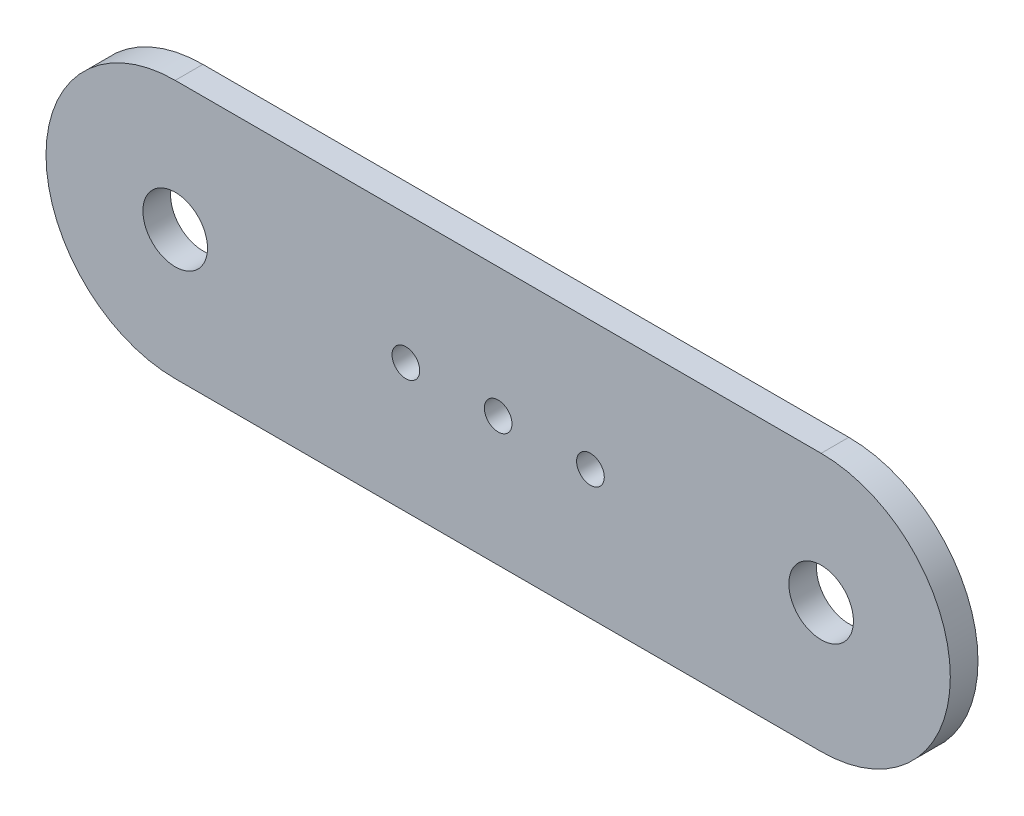
from build123d import *

# Parameters (mm, degrees)
SKETCH1_R           = 1.5
SKETCH1_R_2         = 3.5
BOSS_EXTRUDE1_DEPTH = 3


with BuildPart() as part:
    # Sketch1 → Boss-Extrude1 (new body)
    with BuildSketch(Plane.XY):
        with BuildLine():
            Line((0, 14), (70, 14))
            ThreePointArc((70, 14), (84, 0), (70, -14))
            Line((70, -14), (0, -14))
            ThreePointArc((0, -14), (-14, 0), (0, 14))
        make_face()
        with Locations((25, 0)):
            Circle(SKETCH1_R, mode=Mode.SUBTRACT)
        Circle(SKETCH1_R_2, mode=Mode.SUBTRACT)
        with Locations((35, 0)):
            Circle(SKETCH1_R, mode=Mode.SUBTRACT)
        with Locations((45, 0)):
            Circle(SKETCH1_R, mode=Mode.SUBTRACT)
        with Locations((70, 0)):
            Circle(SKETCH1_R_2, mode=Mode.SUBTRACT)
    extrude(amount=BOSS_EXTRUDE1_DEPTH)


solid = part.part
